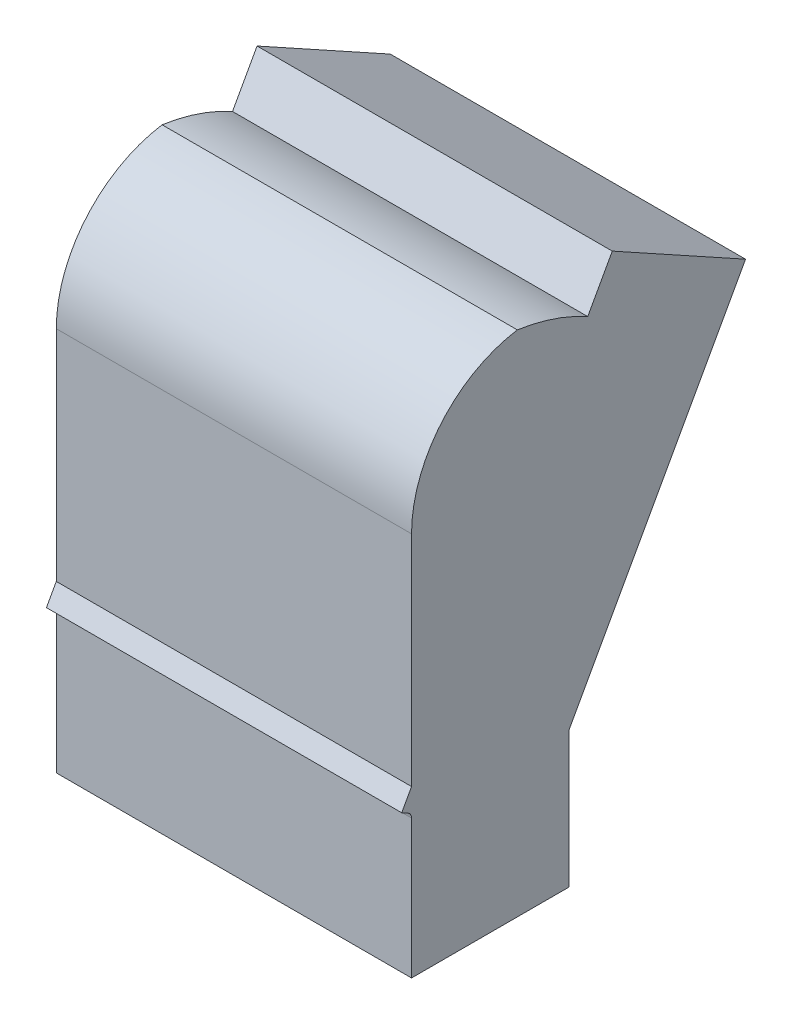
from build123d import *

# Parameters (mm, degrees)
BOSS_EXTRUDE1_DEPTH = 177.8
BOSS_EXTRUDE2_DEPTH = 177.8


with BuildPart() as part:
    # Sketch2 → Boss-Extrude1 (new body)
    with BuildSketch(Plane(origin=(0, 0, 0), x_dir=(0, 0, -1), z_dir=(1, 0, 0))):
        with BuildLine():
            Line((9.446959598, 242.605367243), (76.143806671, 205.754714731))
            Line((76.143806671, 205.754714731), (0.427641882, 68.714279363))
            ThreePointArc((0.427641882, 68.714279363), (0.108631196, 67.912266317), (0, 67.056))
            Line((0, 67.056), (0, 0))
            Line((0, 0), (-78.74, 0))
            Line((-78.74, 0), (-78.74, 69.342))
            ThreePointArc((-78.74, 69.342), (-79.215672983, 71.084383578), (-80.510720637, 72.343358118))
            Line((-80.510720637, 72.343358118), (-83.662355749, 74.084666973))
            Line((-83.662355749, 74.084666973), (-78.74, 82.993752329))
            Line((-78.74, 82.993752329), (-78.74, 192.532))
            ThreePointArc((-78.74, 192.532), (-63.696886188, 233.267747455), (-25.788612916, 254.449324625))
            ThreePointArc((-25.788612916, 254.449324625), (-7.634921788, 250.121653844), (9.446959598, 242.605367243))
        make_face()
    extrude(amount=BOSS_EXTRUDE1_DEPTH)

    # Sketch3 → Boss-Extrude2 (add)
    with BuildSketch(Plane(origin=(177.8, 0, 0), x_dir=(0, 0, -1), z_dir=(1, 0, 0))):
        Polygon((76.143806671, 205.754714731), (88.427357508, 227.986997088), (21.730510436, 264.8376496), (9.446959598, 242.605367243), align=None)
    extrude(amount=-BOSS_EXTRUDE2_DEPTH)


solid = part.part
